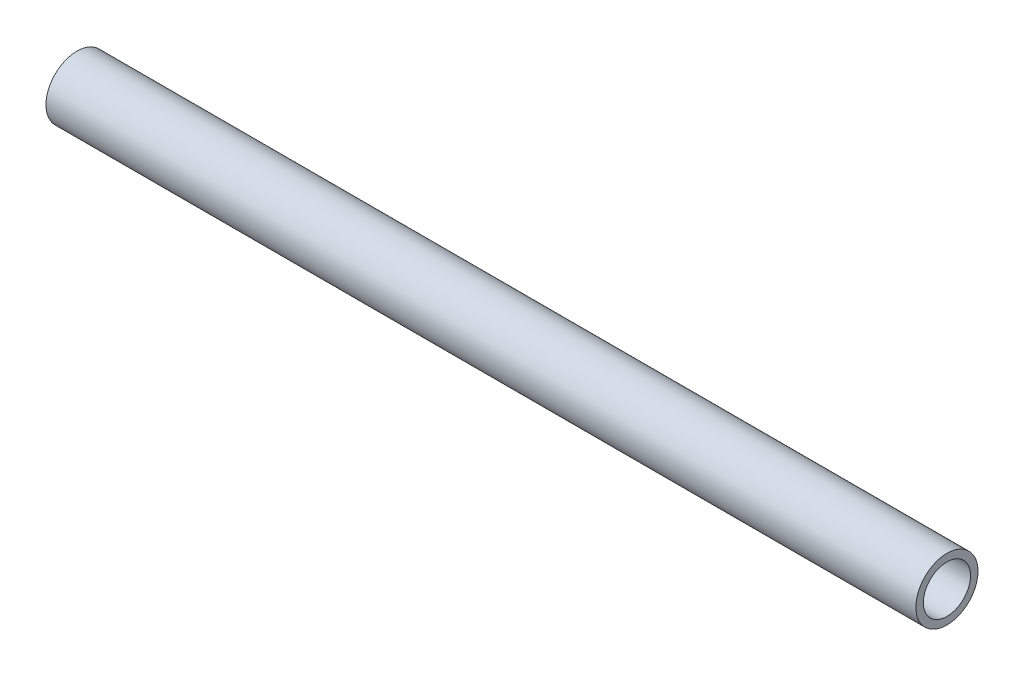
from build123d import *

# Parameters (mm, degrees)
SKETCH1_R           = 12.7
SKETCH1_R_2         = 9.652
BOSS_EXTRUDE1_DEPTH = 355.6


with BuildPart() as part:
    # Sketch1 → Boss-Extrude1 (new body)
    with BuildSketch(Plane(origin=(0, 0, 0), x_dir=(0, 0, -1), z_dir=(1, 0, 0))):
        Circle(SKETCH1_R)
        Circle(SKETCH1_R_2, mode=Mode.SUBTRACT)
    extrude(amount=BOSS_EXTRUDE1_DEPTH)


solid = part.part
